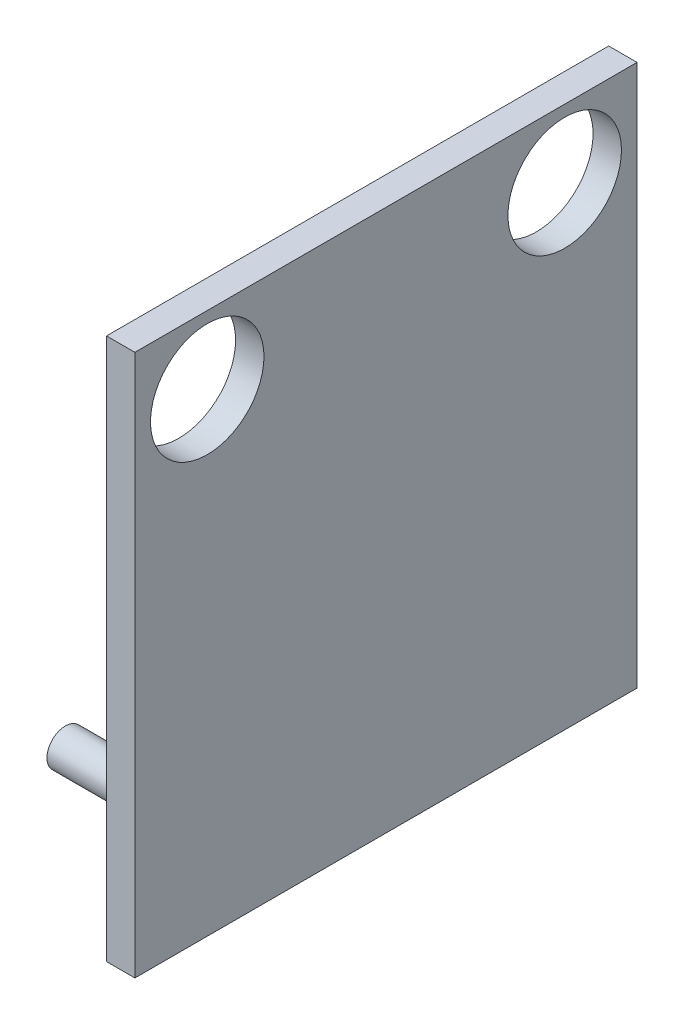
from build123d import *

# Parameters (mm, degrees)
SKETCH1_W           = 17.7
SKETCH1_H           = 19.1
SKETCH1_R           = 2
BOSS_EXTRUDE1_DEPTH = 1
SKETCH2_W           = 14
SKETCH2_H           = 2.54
SKETCH2_W_2         = 5
SKETCH2_H_2         = 5
BOSS_EXTRUDE2_DEPTH = 1
SKETCH3_R           = 1.15
BOSS_EXTRUDE3_DEPTH = 1
SKETCH4_R           = 0.65
BOSS_EXTRUDE4_DEPTH = 3


with BuildPart() as part:
    # Sketch1 → Boss-Extrude1 (new body)
    with BuildSketch(Plane(origin=(0, 0, 0), x_dir=(0, 0, -1), z_dir=(1, 0, 0))):
        with Locations((8.85, 9.55)):
            Rectangle(SKETCH1_W, SKETCH1_H)
        with Locations((15.15, 16.7)):
            Circle(SKETCH1_R, mode=Mode.SUBTRACT)
        with Locations((2.55, 16.7)):
            Circle(SKETCH1_R, mode=Mode.SUBTRACT)
    extrude(amount=BOSS_EXTRUDE1_DEPTH)

    # Sketch2 → Boss-Extrude2 (add)
    with BuildSketch(Plane.ZY):
        with Locations((-8.85, 2.27)):
            Rectangle(SKETCH2_W, SKETCH2_H)
        with Locations((-8.85, 9.55)):
            Rectangle(SKETCH2_W_2, SKETCH2_H_2)
    extrude(amount=BOSS_EXTRUDE2_DEPTH)

    # Sketch3 → Boss-Extrude3 (add)
    with BuildSketch(Plane.ZY.offset(1)):
        with Locations((-14.35, 2.27)):
            Circle(SKETCH3_R)
        with Locations((-11.65, 2.27)):
            Circle(SKETCH3_R)
        with Locations((-8.95, 2.27)):
            Circle(SKETCH3_R)
        with Locations((-6.25, 2.27)):
            Circle(SKETCH3_R)
        with Locations((-3.55, 2.27)):
            Circle(SKETCH3_R)
    extrude(amount=BOSS_EXTRUDE3_DEPTH)

    # Sketch4 → Boss-Extrude4 (add)
    with BuildSketch(Plane.ZY.offset(2)):
        with Locations((-14.35, 2.27)):
            Circle(SKETCH4_R)
        with Locations((-11.65, 2.27)):
            Circle(SKETCH4_R)
        with Locations((-8.95, 2.27)):
            Circle(SKETCH4_R)
        with Locations((-6.25, 2.27)):
            Circle(SKETCH4_R)
        with Locations((-3.55, 2.27)):
            Circle(SKETCH4_R)
    extrude(amount=BOSS_EXTRUDE4_DEPTH)


solid = part.part
